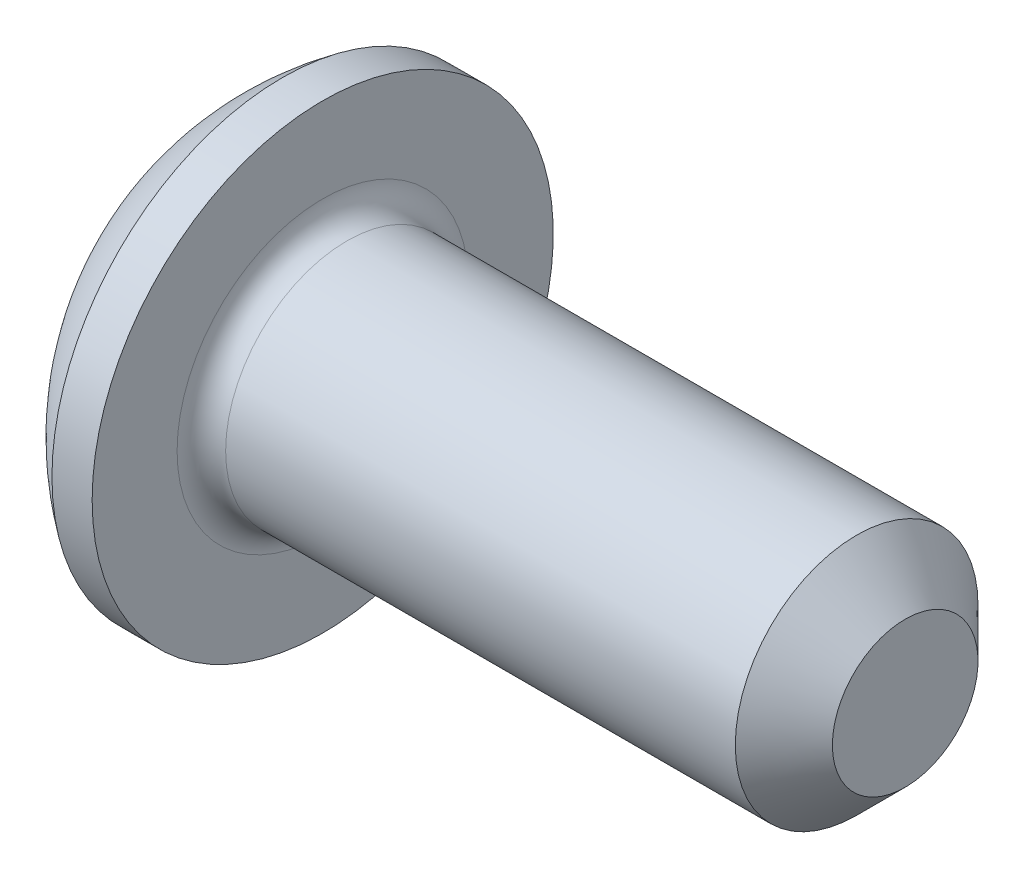
from build123d import *

# Parameters (mm, degrees)
CUT_EXTRUDE_1_DEPTH      = 14.752272539
CUT_EXTRUDE_1_DEPTH_BACK = 14.752272539
CUT_EXTRUDE_2_DEPTH      = 1.8


with BuildPart() as part:
    # Эскиз1 → Revolve 663 (revolve)
    with BuildSketch(Plane.XY, mode=Mode.PRIVATE) as revolve_663_sk:
        with BuildLine():
            Line((0, 4.75), (0, 3))
            ThreePointArc((0, 3), (0.146446609, 2.646446609), (0.5, 2.5))
            Line((0.5, 2.5), (11, 2.5))
            Line((11, 2.5), (12, 1.5))
            Line((12, 1.5), (12, 0))
            Line((12, 0), (-3.3, 0))
            ThreePointArc((-3.3, 0), (-2.645098129, 2.677305593), (-0.828287848, 4.75))
            Line((-0.828287848, 4.75), (0, 4.75))
        make_face()
    revolve(revolve_663_sk.sketch.rotate(Axis((-6.611599553, 0, 0), (1, 0, 0)), 90), axis=Axis((-6.611599553, 0, 0), (1, 0, 0)))

    # Эскиз2 → Вырез-Вытянуть1 (cut, two sides: drawn at the far end of the back side and taken through both)
    with BuildSketch(Plane.XY.offset(-CUT_EXTRUDE_1_DEPTH_BACK)):
        Polygon((-2.75, 45.30562747), (-2.75, 2.465258607), (-2.75, -2.465258607), (-2.75, -45.30562747), (-88.430737726, -45.30562747), (-88.430737726, 45.30562747), align=None)
    extrude(amount=CUT_EXTRUDE_1_DEPTH + CUT_EXTRUDE_1_DEPTH_BACK, mode=Mode.SUBTRACT)

    # Эскиз3 → Вырез-Вытянуть2 (cut)
    with BuildSketch(Plane.ZY.offset(2.75)):
        Polygon((-1.732050808, 0), (-0.866025404, -1.5), (0.866025404, -1.5), (1.732050808, 0), (0.866025404, 1.5), (-0.866025404, 1.5), align=None)
    extrude(amount=-CUT_EXTRUDE_2_DEPTH, mode=Mode.SUBTRACT)


solid = part.part
